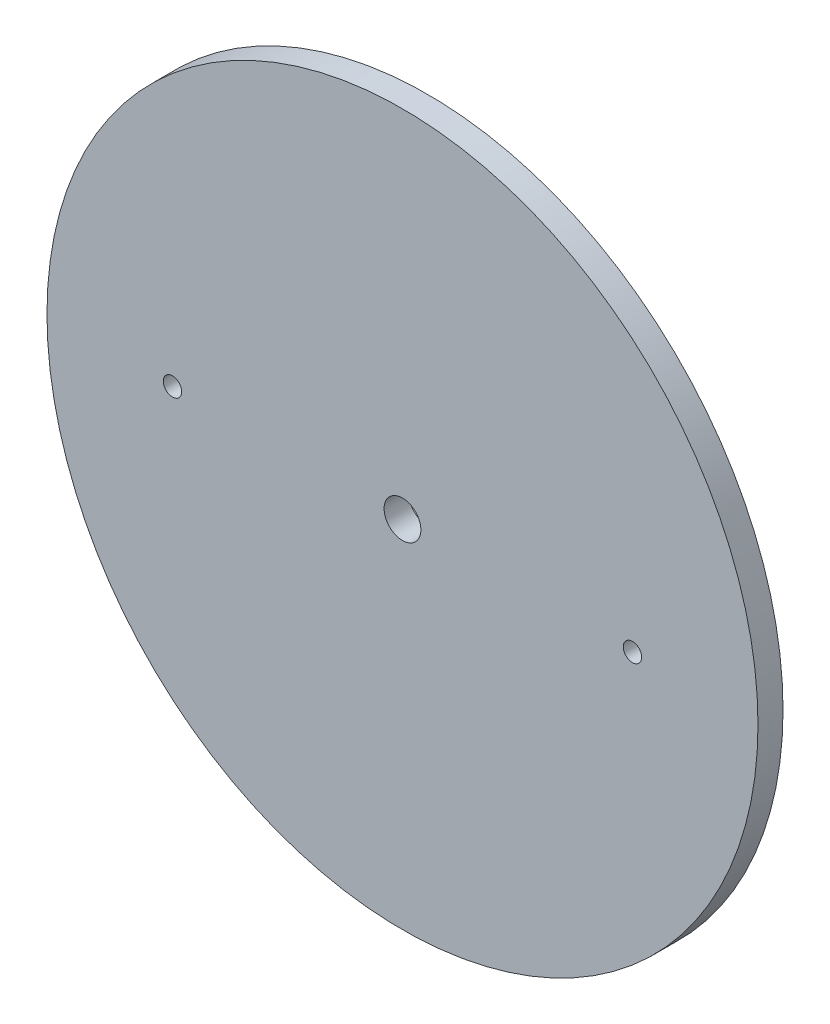
from build123d import *

# Parameters (mm, degrees)
SKETCH1_R           = 71
SKETCH1_R_2         = 1.837270341
SKETCH1_R_3         = 3.674540682
BOSS_EXTRUDE1_DEPTH = 5


with BuildPart() as part:
    # Sketch1 → Boss-Extrude1 (new body)
    with BuildSketch(Plane(origin=(0, 0, -5), x_dir=(-1, 0, 0), z_dir=(0, 0, -1))):
        with Locations(Location((0, 0, 0), (0, 0, 180))):
            Circle(SKETCH1_R)
        with Locations(Location((45.93175853, 0, 0), (0, 0, 180))):
            Circle(SKETCH1_R_2, mode=Mode.SUBTRACT)
        with Locations(Location((-45.93175853, 0, 0), (0, 0, 180))):
            Circle(SKETCH1_R_2, mode=Mode.SUBTRACT)
        with Locations(Location((0, 0, 0), (0, 0, 180))):
            Circle(SKETCH1_R_3, mode=Mode.SUBTRACT)
    extrude(amount=-BOSS_EXTRUDE1_DEPTH)


solid = part.part
